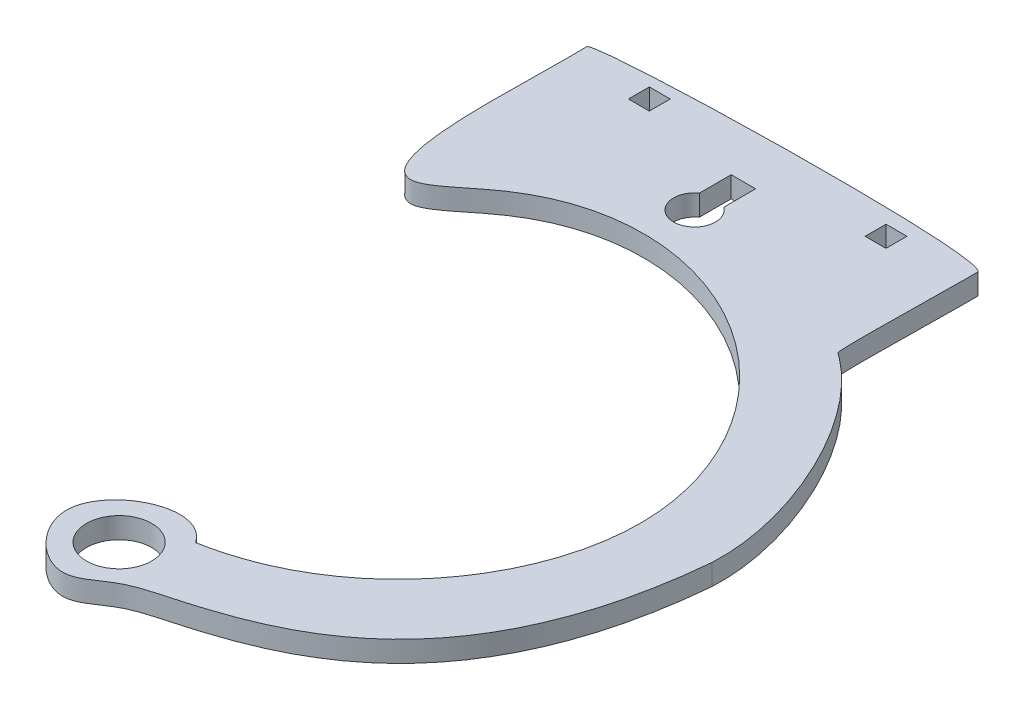
from build123d import *

# Parameters (mm, degrees)
BOSS_EXTRUDE1_DEPTH = 3
SKETCH2_R           = 4.675
CUT_EXTRUDE1_DEPTH  = 3
SKETCH4_R           = 3
CUT_EXTRUDE2_DEPTH  = 6
SKETCH5_W           = 3.5
SKETCH5_H           = 8
CUT_EXTRUDE3_DEPTH  = 6
SKETCH7_W           = 3
SKETCH7_H           = 3
CUT_EXTRUDE4_DEPTH  = 158.230726434


with BuildPart() as part:
    # Sketch1 → Boss-Extrude1 (new body)
    with BuildSketch(Plane(origin=(0, 0, 0), x_dir=(1, 0, 0), z_dir=(0, 1, 0))):
        with BuildLine():
            add(Edge.make_bspline(
                [(5.521557484, -34.56171875), (23.441000999, -31.411738399), (44.462398529, -2.858835803), (20.37501589, 35.351246157), (-9.407254112, 38.543487929), (-30.226183483, 17.996603235), (-27.722542629, 45.347476833), (-28.043237247, 56.504189732), (28.011039588, 57.687968628), (27.966939535, 46.950288995), (27.653737943, 35.240695817), (37.551526977, 28.360483653), (45.587235651, 11.449809119), (45, 0)],
                knots=[0, 0, 0, 0, 0.082837565, 0.14873935, 0.208270658, 0.22410066, 0.277626869, 0.277626869, 0.285968064, 0.285968064, 0.310947599, 0.310947599, 1, 1, 1, 1], degree=3))
            add(Edge.make_bspline(
                [(45, 0), (41.835073021, -33.835409187), (19.767205368, -40.752570405), (4.477815504, -44.870859065), (-0.816124688, -50.460563609), (-14.262812638, -37.3251738), (1.754576266, -29.067892634), (5.521557484, -34.56171875)],
                knots=[0, 0, 0, 0, 0.439042234, 0.498130667, 0.590884333, 0.751564072, 1, 1, 1, 1], degree=3))
        make_face()
    extrude(amount=BOSS_EXTRUDE1_DEPTH)

    # Sketch2 → Cut-Extrude1 (cut)
    with BuildSketch(Plane(origin=(0, 3, 0), x_dir=(1, 0, 0), z_dir=(0, 1, 0))):
        with Locations(Location((0, -40, 0), (0, 0, 270))):
            Circle(SKETCH2_R)
    extrude(amount=-CUT_EXTRUDE1_DEPTH, mode=Mode.SUBTRACT)

    # Sketch4 → Cut-Extrude2 (cut)
    with BuildSketch(Plane(origin=(0, 3, 0), x_dir=(1, 0, 0), z_dir=(0, 1, 0))):
        with Locations(Location((0, 42.471796211, 0), (0, 0, 270))):
            Circle(SKETCH4_R)
    extrude(amount=-CUT_EXTRUDE2_DEPTH, mode=Mode.SUBTRACT)

    # Sketch5 → Cut-Extrude3 (cut)
    with BuildSketch(Plane(origin=(0, 3, 0), x_dir=(1, 0, 0), z_dir=(0, 1, 0))):
        with Locations((0, 45.471796211)):
            Rectangle(SKETCH5_W, SKETCH5_H)
    extrude(amount=-CUT_EXTRUDE3_DEPTH, mode=Mode.SUBTRACT)

    # Sketch7 → Cut-Extrude4 (cut, through all)
    with BuildSketch(Plane(origin=(-39.031738827, 3, -85.075009547), x_dir=(0.9999974019244963, 0, 0.002279505265952002), z_dir=(0, 1, 0))):
        with Locations((22.0910666, -32.023534202)):
            Rectangle(SKETCH7_W, SKETCH7_H)
        with Locations((56.0910666, -32.023534202)):
            Rectangle(SKETCH7_W, SKETCH7_H)
    extrude(amount=-CUT_EXTRUDE4_DEPTH, mode=Mode.SUBTRACT)


solid = part.part
